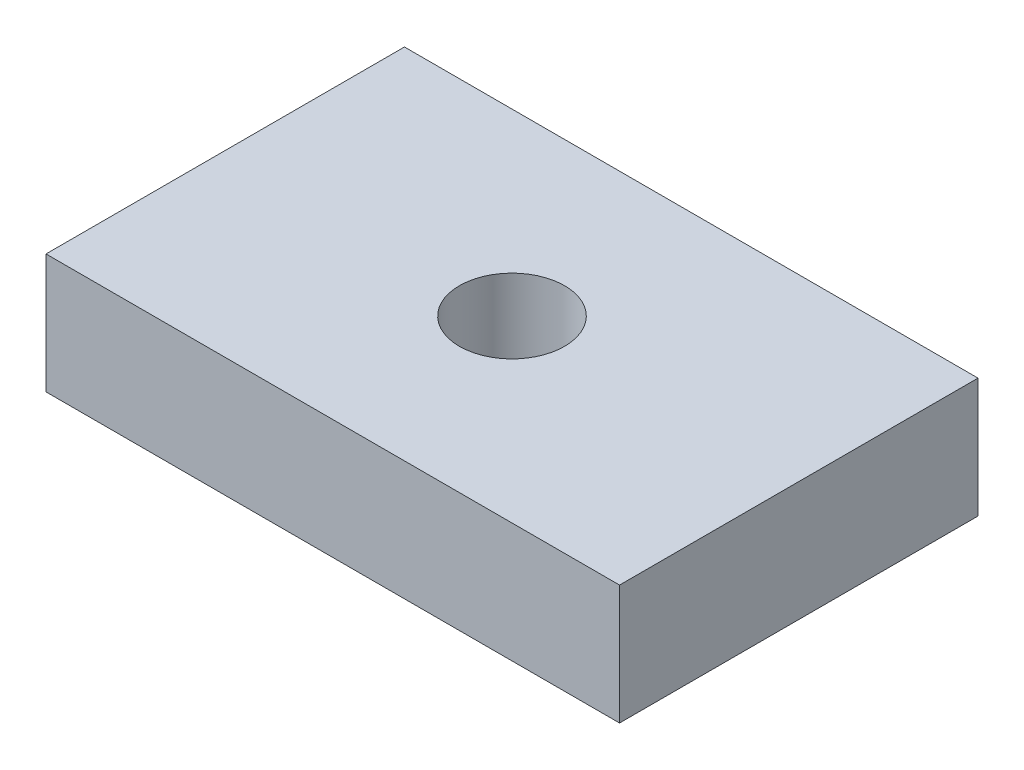
from build123d import *

# Parameters (mm, degrees)
SKETCH1_W           = 24
SKETCH1_H           = 15
SKETCH1_R           = 2.2
BOSS_EXTRUDE1_DEPTH = 5


with BuildPart() as part:
    # Sketch1 → Boss-Extrude1 (new body)
    with BuildSketch(Plane(origin=(0, 0, 0), x_dir=(1, 0, 0), z_dir=(0, 1, 0))):
        Rectangle(SKETCH1_W, SKETCH1_H)
        with Locations(Location((0, 0, 0), (0, 0, 270))):
            Circle(SKETCH1_R, mode=Mode.SUBTRACT)
    extrude(amount=BOSS_EXTRUDE1_DEPTH)


solid = part.part
